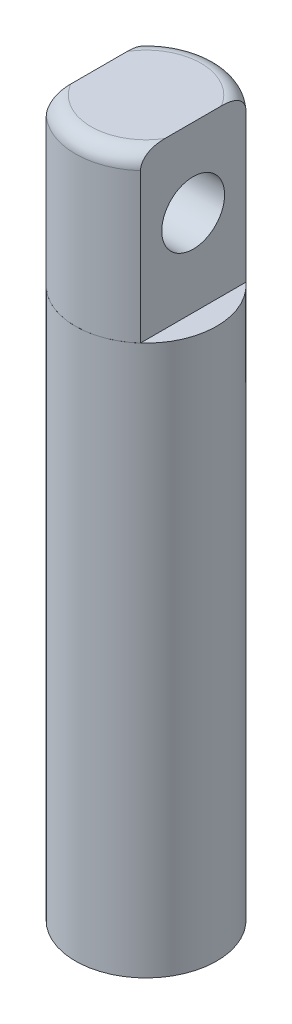
from build123d import *

# Parameters (mm, degrees)
SKETCH_1_R          = 4.5
EXTRUDE_1_DEPTH     = 10.5
CUT_EXTRUDE_START   = -10.5
CUT_EXTRUDE_1_DEPTH = 10.5
CUT_EXTRUDE_2_REACH = 14.903
SKETCH_3_R          = 2
SKETCH_4_R          = 4.5
EXTRUDE_2_DEPTH     = 35
FILLET_1_R          = 1


with BuildPart() as part:
    # 草图1 → 凸台-拉伸1 (new body)
    with BuildSketch(Plane(origin=(0, 0, 0), x_dir=(1, 0, 0), z_dir=(0, 1, 0))):
        with Locations(Location((0, 0, 0), (0, 0, 90))):
            Circle(SKETCH_1_R)
    extrude(amount=EXTRUDE_1_DEPTH)

    # 草图2 → 切除-拉伸1 (cut)
    with BuildSketch(Plane(origin=(0, 10.5, 0), x_dir=(1, 0, 0), z_dir=(0, 1, 0)).offset(CUT_EXTRUDE_START)):
        with BuildLine():
            Line((-3, -3.354101966), (-3, 3.354101966))
            ThreePointArc((-3, 3.354101966), (-4.5, 0), (-3, -3.354101966))
        make_face()
        with BuildLine():
            ThreePointArc((4.5, 0), (4.107919181, 1.837117307), (3, 3.354101966))
            Line((3, 3.354101966), (3, -3.354101966))
            ThreePointArc((3, -3.354101966), (4.107919181, -1.837117307), (4.5, 0))
        make_face()
    extrude(amount=CUT_EXTRUDE_1_DEPTH, mode=Mode.SUBTRACT)

    # 草图3 → 切除-拉伸2 (cut, up to next)
    with BuildSketch(Plane.ZY.offset(3), mode=Mode.PRIVATE) as cut_extrude_2_sk1:
        with Locations((0, 5.5)):
            Circle(SKETCH_3_R)
    cut_extrude_2_tool1 = extrude(cut_extrude_2_sk1.sketch, amount=-CUT_EXTRUDE_2_REACH, mode=Mode.PRIVATE) & part.part
    add(cut_extrude_2_tool1.solids().sort_by_distance((-3, 5.5, 0))[0], mode=Mode.SUBTRACT)

    # 圆角1
    fillet_1_edges = [part.edges().sort_by_distance(p)[0] for p in [
        (0, 10.5, -4.5),
        (0, 10.5, 4.5),
    ]]
    fillet(fillet_1_edges, radius=FILLET_1_R)


with BuildPart() as body_2:
    # 草图4 → 凸台-拉伸2 (new body)
    with BuildSketch(Plane.XZ):
        with Locations(Location((0, 0, 0), (0, 0, 270))):
            Circle(SKETCH_4_R)
    extrude(amount=EXTRUDE_2_DEPTH)


solid = Compound([part.part, body_2.part])
